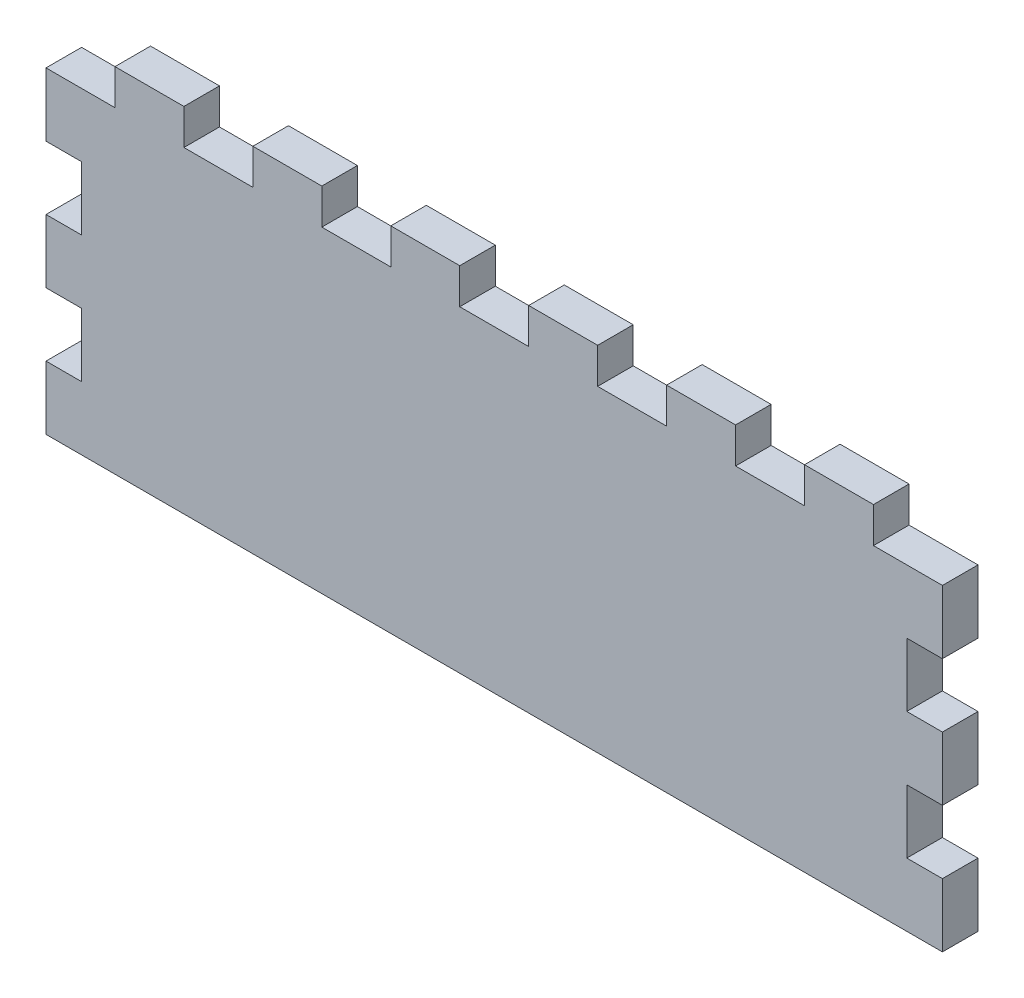
from build123d import *

# Parameters (mm, degrees)
SKETCH1_W           = 80
SKETCH1_H           = 80
BOSS_EXTRUDE1_DEPTH = 1.5875
SKETCH2_OUTSIDE_W   = 104.636
SKETCH2_OUTSIDE_H   = 104.636
CUT_EXTRUDE2_DEPTH  = 10
SKETCH3_W           = 80
SKETCH3_H           = 48.498076923
CUT_EXTRUDE3_DEPTH  = 57.657573413


with BuildPart() as part:
    # Sketch1 → Boss-Extrude1 (new, symmetric)
    with BuildSketch(Plane.XY):
        Rectangle(SKETCH1_W, SKETCH1_H)
    extrude(amount=BOSS_EXTRUDE1_DEPTH, both=True)

    # Sketch2 outside → Cut-Extrude2 (cut)
    with BuildSketch(Plane.XY.offset(1.5875)):
        Rectangle(SKETCH2_OUTSIDE_W, SKETCH2_OUTSIDE_H)
        Polygon((33.846153846, -36.825), (40, -36.825), (40, -31.159615385), (36.82, -31.159615385), (36.82, -25.494230769), (40, -25.494230769), (40, -19.828846154), (36.82, -19.828846154), (36.82, -14.163461538), (40, -14.163461538), (40, -8.498076923), (36.82, -8.498076923), (36.82, -2.832692308), (40, -2.832692308), (40, 2.832692308), (36.82, 2.832692308), (36.82, 8.498076923), (40, 8.498076923), (40, 14.163461538), (36.82, 14.163461538), (36.82, 19.828846154), (40, 19.828846154), (40, 25.494230769), (36.82, 25.494230769), (36.82, 31.159615385), (40, 31.159615385), (40, 36.825), (33.846153846, 36.825), (33.846153846, 40), (27.692307692, 40), (27.692307692, 36.825), (21.538461538, 36.825), (21.538461538, 40), (15.384615385, 40), (15.384615385, 36.825), (9.230769231, 36.825), (9.230769231, 40), (3.076923077, 40), (3.076923077, 36.825), (-3.076923077, 36.825), (-3.076923077, 40), (-9.230769231, 40), (-9.230769231, 36.825), (-15.384615385, 36.825), (-15.384615385, 40), (-21.538461538, 40), (-21.538461538, 36.825), (-27.692307692, 36.825), (-27.692307692, 40), (-33.846153846, 40), (-33.846153846, 36.825), (-40, 36.825), (-40, 31.159615385), (-36.82, 31.159615385), (-36.82, 25.494230769), (-40, 25.494230769), (-40, 19.828846154), (-36.82, 19.828846154), (-36.82, 14.163461538), (-40, 14.163461538), (-40, 8.498076923), (-36.82, 8.498076923), (-36.82, 2.832692308), (-40, 2.832692308), (-40, -2.832692308), (-36.82, -2.832692308), (-36.82, -8.498076923), (-40, -8.498076923), (-40, -14.163461538), (-36.82, -14.163461538), (-36.82, -19.828846154), (-40, -19.828846154), (-40, -25.494230769), (-36.82, -25.494230769), (-36.82, -31.159615385), (-40, -31.159615385), (-40, -36.825), (-33.846153846, -36.825), (-33.846153846, -40), (-27.692307692, -40), (-27.692307692, -36.825), (-21.538461538, -36.825), (-21.538461538, -40), (-15.384615385, -40), (-15.384615385, -36.825), (-9.230769231, -36.825), (-9.230769231, -40), (-3.076923077, -40), (-3.076923077, -36.825), (3.076923077, -36.825), (3.076923077, -40), (9.230769231, -40), (9.230769231, -36.825), (15.384615385, -36.825), (15.384615385, -40), (21.538461538, -40), (21.538461538, -36.825), (27.692307692, -36.825), (27.692307692, -40), (33.846153846, -40), align=None, mode=Mode.SUBTRACT)
    extrude(amount=-CUT_EXTRUDE2_DEPTH, mode=Mode.SUBTRACT)

    # Sketch3 → Cut-Extrude3 (cut, through all)
    with BuildSketch(Plane.XY.offset(1.5875)):
        with Locations((0, -15.750961539)):
            Rectangle(SKETCH3_W, SKETCH3_H)
    extrude(amount=-CUT_EXTRUDE3_DEPTH, mode=Mode.SUBTRACT)


solid = part.part
